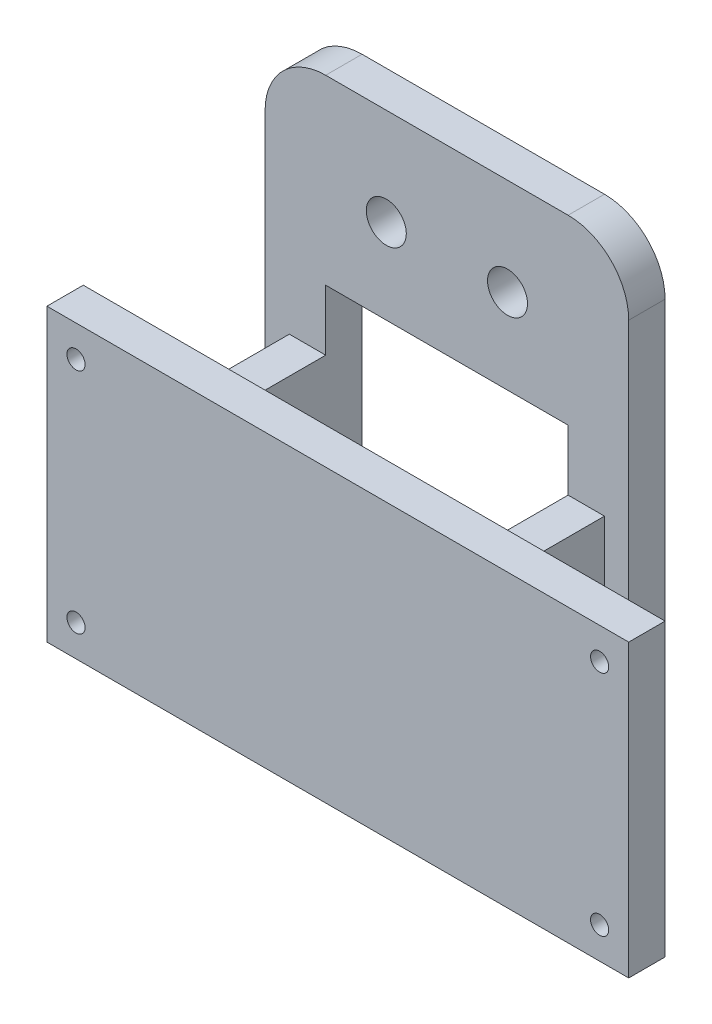
from build123d import *

# Parameters (mm, degrees)
SKETCH_1_W          = 30
SKETCH_1_H          = 35
SKETCH_1_R          = 1.65
EXTRUDE_1_DEPTH     = 3
SKETCH_2_W          = 20
SKETCH_2_H          = 20
CUT_EXTRUDE_1_DEPTH = 6
SKETCH_3_W          = 3
SKETCH_3_H          = 15
EXTRUDE_2_DEPTH     = 6
SKETCH_4_W          = 48
SKETCH_4_H          = 24
EXTRUDE_3_DEPTH     = 3
SKETCH_6_R          = 0.75
CUT_EXTRUDE_2_DEPTH = 5


with BuildPart() as part:
    # 草图1 → 凸台-拉伸1 (new body)
    with BuildSketch(Plane.XY):
        with Locations((5.815384615, -13.146153846)):
            Rectangle(SKETCH_1_W, SKETCH_1_H)
        with Locations((0.815384615, -3.646153846)):
            Circle(SKETCH_1_R, mode=Mode.SUBTRACT)
        with Locations((10.815384615, -3.646153846)):
            Circle(SKETCH_1_R, mode=Mode.SUBTRACT)
    extrude(amount=EXTRUDE_1_DEPTH)

    # 草图2 → 切除-拉伸1 (cut)
    with BuildSketch(Plane.XY.offset(3)):
        with Locations((5.815384615, -20.646153846)):
            Rectangle(SKETCH_2_W, SKETCH_2_H)
        with BuildLine():
            Line((-9.184615385, -0.646153846), (-9.184615385, 4.353846154))
            Line((-9.184615385, 4.353846154), (-4.184615385, 4.353846154))
            ThreePointArc((-4.184615385, 4.353846154), (-7.720149291, 2.88938006), (-9.184615385, -0.646153846))
        make_face()
        with BuildLine():
            Line((20.815384615, -0.646153846), (20.815384615, 4.353846154))
            Line((20.815384615, 4.353846154), (15.815384615, 4.353846154))
            ThreePointArc((15.815384615, 4.353846154), (19.350918521, 2.88938006), (20.815384615, -0.646153846))
        make_face()
    extrude(amount=-CUT_EXTRUDE_1_DEPTH, mode=Mode.SUBTRACT)

    # 草图3 → 凸台-拉伸2 (add)
    with BuildSketch(Plane.XY.offset(3)):
        with Locations((-5.684615385, -23.146153846)):
            Rectangle(SKETCH_3_W, SKETCH_3_H)
        with Locations((17.315384615, -23.146153846)):
            Rectangle(SKETCH_3_W, SKETCH_3_H)
    extrude(amount=EXTRUDE_2_DEPTH)

    # 草图4 → 凸台-拉伸3 (add)
    with BuildSketch(Plane.XY.offset(9)):
        with Locations((5.815384615, -26.646153846)):
            Rectangle(SKETCH_4_W, SKETCH_4_H)
    extrude(amount=EXTRUDE_3_DEPTH)

    # 草图6 → 切除-拉伸2 (cut)
    with BuildSketch(Plane.XY.offset(12)):
        with Locations((-15.784615385, -17.246153846)):
            Circle(SKETCH_6_R)
        with Locations((-15.784615385, -36.046153846)):
            Circle(SKETCH_6_R)
        with Locations((27.415384615, -36.046153846)):
            Circle(SKETCH_6_R)
        with Locations((27.415384615, -17.246153846)):
            Circle(SKETCH_6_R)
    extrude(amount=-CUT_EXTRUDE_2_DEPTH, mode=Mode.SUBTRACT)


solid = part.part
